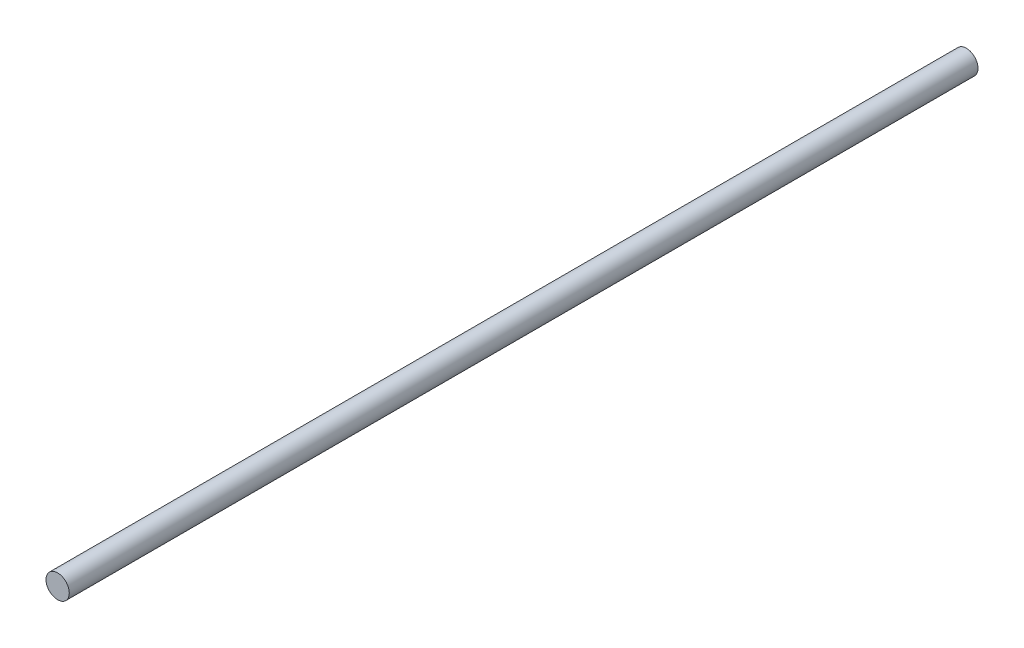
from build123d import *

# Parameters (mm, degrees)
ESQUISSE1_R        = 2.5
BOSS_EXTRU_1_DEPTH = 195


with BuildPart() as part:
    # Esquisse1 → Boss.-Extru.1 (new body)
    with BuildSketch(Plane.XY):
        Circle(ESQUISSE1_R)
    extrude(amount=BOSS_EXTRU_1_DEPTH)


solid = part.part
